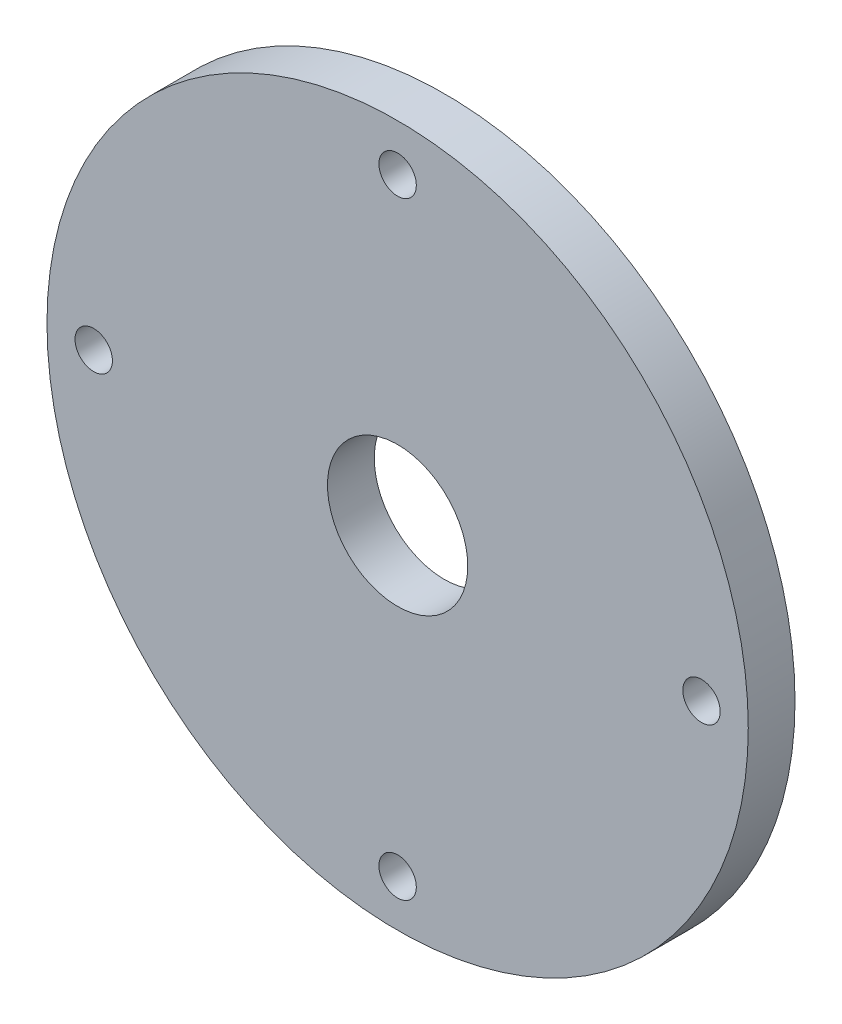
from build123d import *

# Parameters (mm, degrees)
SKETCH1_R           = 75
SKETCH1_R_2         = 15
SKETCH1_R_3         = 4
BOSS_EXTRUDE1_DEPTH = 10


with BuildPart() as part:
    # Sketch1 → Boss-Extrude1 (new body)
    with BuildSketch(Plane.XY):
        Circle(SKETCH1_R)
        Circle(SKETCH1_R_2, mode=Mode.SUBTRACT)
        with Locations((0, 65)):
            Circle(SKETCH1_R_3, mode=Mode.SUBTRACT)
        with Locations((-65, 0)):
            Circle(SKETCH1_R_3, mode=Mode.SUBTRACT)
        with Locations((0, -65)):
            Circle(SKETCH1_R_3, mode=Mode.SUBTRACT)
        with Locations((65, 0)):
            Circle(SKETCH1_R_3, mode=Mode.SUBTRACT)
    extrude(amount=BOSS_EXTRUDE1_DEPTH)


solid = part.part
